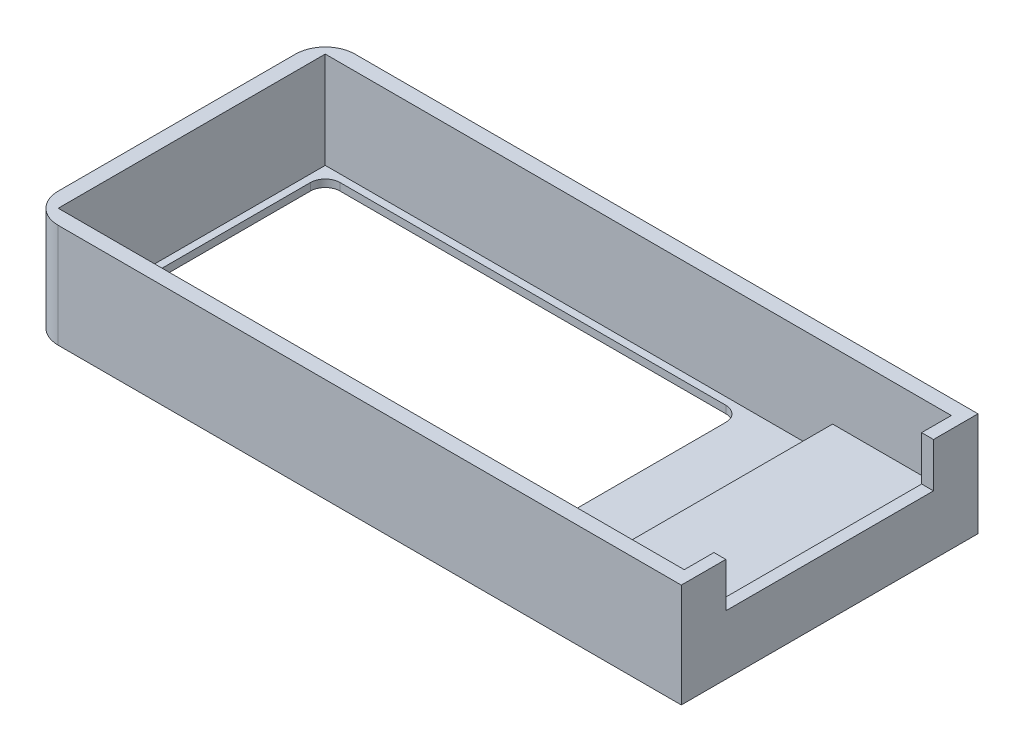
from build123d import *

# Parameters (mm, degrees)
SKETCH1_W           = 44
SKETCH1_H           = 20
BOSS_EXTRUDE1_DEPTH = 7
SKETCH2_W           = 42.2
SKETCH2_H           = 18
CUT_EXTRUDE1_DEPTH  = 6.5
CUT_EXTRUDE2_REACH  = 50.767
SKETCH3_W           = 28
SKETCH3_H           = 17
SKETCH4_W           = 8
SKETCH4_H           = 18
BOSS_EXTRUDE2_DEPTH = 2
SKETCH5_W           = 0.8
SKETCH5_H           = 14
CUT_EXTRUDE3_DEPTH  = 3
FILLET1_R           = 2
FILLET2_R           = 1


with BuildPart() as part:
    # Sketch1 → Boss-Extrude1 (new body)
    with BuildSketch(Plane(origin=(0, 0, 0), x_dir=(1, 0, 0), z_dir=(0, 1, 0))):
        with Locations((22, 10)):
            Rectangle(SKETCH1_W, SKETCH1_H)
    extrude(amount=BOSS_EXTRUDE1_DEPTH)

    # Sketch2 → Cut-Extrude1 (cut)
    with BuildSketch(Plane(origin=(0, 7, 0), x_dir=(1, 0, 0), z_dir=(0, 1, 0))):
        with Locations((22.1, 10)):
            Rectangle(SKETCH2_W, SKETCH2_H)
    extrude(amount=-CUT_EXTRUDE1_DEPTH, mode=Mode.SUBTRACT)

    # Sketch3 → Cut-Extrude2 (cut, up to next)
    with BuildSketch(Plane(origin=(0, 0.5, 0), x_dir=(1, 0, 0), z_dir=(0, 1, 0)), mode=Mode.PRIVATE) as cut_extrude2_sk1:
        with Locations((15.5, 10)):
            Rectangle(SKETCH3_W, SKETCH3_H)
    cut_extrude2_tool1 = extrude(cut_extrude2_sk1.sketch, amount=-CUT_EXTRUDE2_REACH, mode=Mode.PRIVATE) & part.part
    add(cut_extrude2_tool1.solids().sort_by_distance((15.5, 0.5, -10))[0], mode=Mode.SUBTRACT)

    # Sketch4 → Boss-Extrude2 (add)
    with BuildSketch(Plane(origin=(0, 0.5, 0), x_dir=(1, 0, 0), z_dir=(0, 1, 0))):
        with Locations((39.2, 10)):
            Rectangle(SKETCH4_W, SKETCH4_H)
    extrude(amount=BOSS_EXTRUDE2_DEPTH)

    # Sketch5 → Cut-Extrude3 (cut)
    with BuildSketch(Plane(origin=(0, 7, 0), x_dir=(1, 0, 0), z_dir=(0, 1, 0))):
        with Locations((43.6, 10)):
            Rectangle(SKETCH5_W, SKETCH5_H)
    extrude(amount=-CUT_EXTRUDE3_DEPTH, mode=Mode.SUBTRACT)

    # Fillet1
    fillet1_edges = [part.edges().sort_by_distance(p)[0] for p in [
        (0, 3.5, -20),
        (0, 3.5, 0),
    ]]
    fillet(fillet1_edges, radius=FILLET1_R)

    # Fillet2
    fillet2_edges = [part.edges().sort_by_distance(p)[0] for p in [
        (1.5, 0.25, -1.5),
        (1.5, 0.25, -18.5),
        (29.5, 0.25, -18.5),
        (29.5, 0.25, -1.5),
    ]]
    fillet(fillet2_edges, radius=FILLET2_R)


solid = part.part
